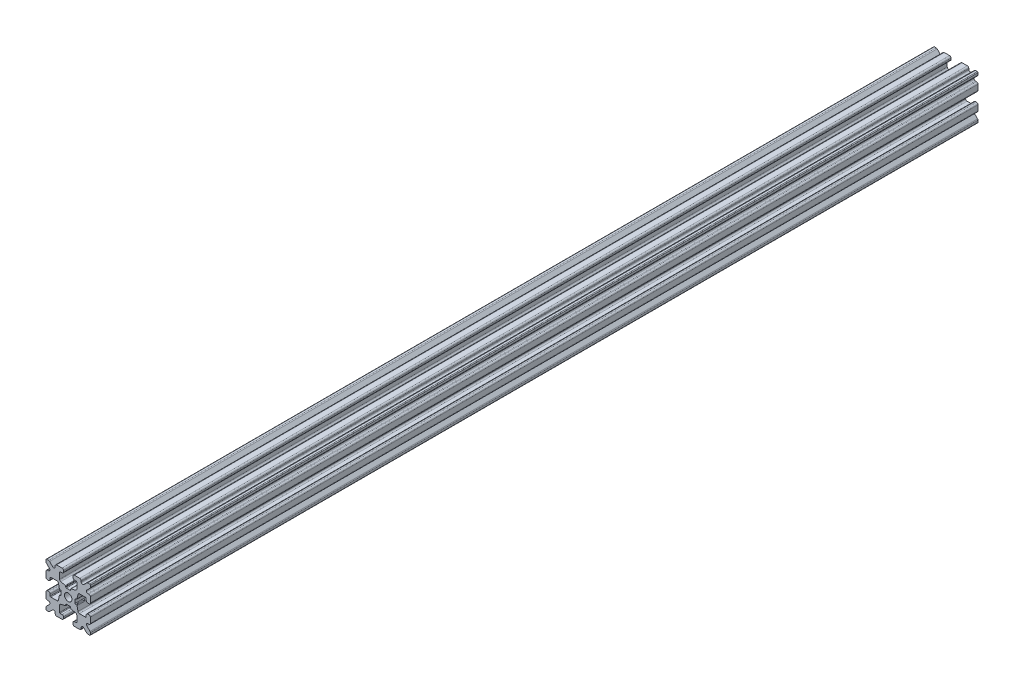
from build123d import *

# Parameters (mm, degrees)
SKETCH1_W           = 15
SKETCH1_H           = 15
SKETCH1_R           = 1.25
CHANGE_LENGTH_DEPTH = 150
FILLET1_R           = 0.25
CUT_EXTRUDE1_DEPTH  = 301.187441443
CUT_EXTRUDE3_DEPTH  = 301.187441443
FILLET3_R           = 0.5
FILLET4_R           = 0.5
FILLET5_R           = 3
FILLET6_R           = 0.2
CUT_EXTRUDE4_DEPTH  = 301.187441443
FILLET8_R           = 0.5
SKETCH6_W           = 5.1529354
SKETCH6_H           = 1.651
SKETCH6_W_2         = 1.651
SKETCH6_H_2         = 5.1529354
CUT_EXTRUDE5_DEPTH  = 301.187441443
FILLET10_R          = 0.2


with BuildPart() as part:
    # Sketch1 → Change length (new, symmetric)
    with BuildSketch(Plane.XY):
        Rectangle(SKETCH1_W, SKETCH1_H)
        Circle(SKETCH1_R, mode=Mode.SUBTRACT)
    extrude(amount=CHANGE_LENGTH_DEPTH, both=True)

    # Fillet1
    fillet1_edges = [part.edges().sort_by_distance(p)[0] for p in [
        (7.5, -7.5, 0),
        (-7.5, -7.5, 0),
        (-7.5, 7.5, 0),
        (7.5, 7.5, 0),
    ]]
    fillet(fillet1_edges, radius=FILLET1_R)

    # Sketch2 → Cut-Extrude1 (cut, through all)
    with BuildSketch(Plane.XY.offset(150)):
        Polygon((-7.5, 1.6), (-6.1, 1.6), (-6.1, 2.9), (-3.4, 2.9), (-3.4, -2.9), (-6.1, -2.9), (-6.1, -1.6), (-7.5, -1.6), align=None)
        Polygon((2.9, 6.1), (1.6, 6.1), (1.6, 7.5), (-1.6, 7.5), (-1.6, 6.1), (-2.9, 6.1), (-2.9, 3.4), (2.9, 3.4), align=None)
        Polygon((-1.6, -7.5), (-1.6, -6.1), (-2.9, -6.1), (-2.9, -3.4), (2.9, -3.4), (2.9, -6.1), (1.6, -6.1), (1.6, -7.5), align=None)
        Polygon((6.1, -2.9), (6.1, -1.6), (7.5, -1.6), (7.5, 1.6), (6.1, 1.6), (6.1, 2.9), (3.4, 2.9), (3.4, -2.9), align=None)
    extrude(amount=-CUT_EXTRUDE1_DEPTH, mode=Mode.SUBTRACT)

    # Sketch4 → Cut-Extrude3 (cut, through all)
    with BuildSketch(Plane.XY.offset(150)):
        Polygon((-3.4, 2.9), (-2.75, 0), (-3.4, -2.9), align=None)
        Polygon((-2.9, 3.4), (0, 2.75), (2.9, 3.4), align=None)
        Polygon((3.4, 2.9), (2.75, 0), (3.4, -2.9), align=None)
        Polygon((-2.9, -3.4), (0, -2.75), (2.9, -3.4), align=None)
    extrude(amount=-CUT_EXTRUDE3_DEPTH, mode=Mode.SUBTRACT)

    # Fillet3
    fillet3_edges = [part.edges().sort_by_distance(p)[0] for p in [
        (1.6, -7.5, 0),
        (-1.6, -7.5, 0),
        (-1.6, -6.1, 0),
        (1.6, -6.1, 0),
        (6.1, 1.6, 0),
        (7.5, 1.6, 0),
        (7.5, -1.6, 0),
        (6.1, -1.6, 0),
        (-7.5, -1.6, 0),
        (-7.5, 1.6, 0),
        (-6.1, 1.6, 0),
        (-6.1, -1.6, 0),
        (-1.6, 6.1, 0),
        (-1.6, 7.5, 0),
        (1.6, 7.5, 0),
        (1.6, 6.1, 0),
    ]]
    fillet(fillet3_edges, radius=FILLET3_R)

    # Fillet4
    fillet4_edges = [part.edges().sort_by_distance(p)[0] for p in [
        (-2.9, -3.4, 0),
        (2.9, -3.4, 0),
        (3.4, -2.9, 0),
        (3.4, 2.9, 0),
        (-3.4, 2.9, 0),
        (-3.4, -2.9, 0),
        (2.9, 3.4, 0),
        (-2.9, 3.4, 0),
    ]]
    fillet(fillet4_edges, radius=FILLET4_R)

    # Fillet5
    fillet5_edges = [part.edges().sort_by_distance(p)[0] for p in [
        (-2.75, 0, 0),
        (0, 2.75, 0),
        (2.75, 0, 0),
        (0, -2.75, 0),
    ]]
    fillet(fillet5_edges, radius=FILLET5_R)

    # Fillet6
    fillet6_edges = [part.edges().sort_by_distance(p)[0] for p in [
        (-2.9, -6.1, 0),
        (2.9, -6.1, 0),
        (6.1, -2.9, 0),
        (6.1, 2.9, 0),
        (-6.1, 2.9, 0),
        (-6.1, -2.9, 0),
        (2.9, 6.1, 0),
        (-2.9, 6.1, 0),
    ]]
    fillet(fillet6_edges, radius=FILLET6_R)

    # Sketch5 → Cut-Extrude4 (cut, through all)
    with BuildSketch(Plane.XY.offset(150)):
        Polygon((-7.5, 6.439339828), (-5.460660172, 4.4), (-7.5, 4.4), align=None)
        Polygon((-6.439339828, 7.5), (-4.4, 5.460660172), (-4.4, 7.5), align=None)
        Polygon((4.4, 7.5), (6.439339828, 7.5), (4.4, 5.460660172), align=None)
        Polygon((7.5, 6.439339828), (7.5, 4.4), (5.460660172, 4.4), align=None)
        Polygon((7.5, -6.439339828), (5.460660172, -4.4), (7.5, -4.4), align=None)
        Polygon((6.439339828, -7.5), (4.4, -5.460660172), (4.4, -7.5), align=None)
        Polygon((-4.4, -7.5), (-6.439339828, -7.5), (-4.4, -5.460660172), align=None)
        Polygon((-7.5, -6.439339828), (-7.5, -4.4), (-5.460660172, -4.4), align=None)
    extrude(amount=-CUT_EXTRUDE4_DEPTH, mode=Mode.SUBTRACT)

    # Fillet8
    fillet8_edges = [part.edges().sort_by_distance(p)[0] for p in [
        (-7.5, 4.4, 0),
        (-7.5, 6.439339828, 0),
        (-5.460660172, 4.4, 0),
        (7.5, -4.4, 0),
        (7.5, -6.439339828, 0),
        (5.460660172, -4.4, 0),
        (5.460660172, 4.4, 0),
        (7.5, 6.439339828, 0),
        (7.5, 4.4, 0),
        (-4.4, 7.5, 0),
        (-4.4, 5.460660172, 0),
        (-6.439339828, 7.5, 0),
        (-5.460660172, -4.4, 0),
        (-7.5, -6.439339828, 0),
        (-7.5, -4.4, 0),
        (4.4, 5.460660172, 0),
        (4.4, 7.5, 0),
        (6.439339828, 7.5, 0),
        (6.439339828, -7.5, 0),
        (4.4, -7.5, 0),
        (4.4, -5.460660172, 0),
        (-6.439339828, -7.5, 0),
        (-4.4, -5.460660172, 0),
        (-4.4, -7.5, 0),
    ]]
    fillet(fillet8_edges, radius=FILLET8_R)

    # Sketch6 → Cut-Extrude5 (cut, through all)
    with BuildSketch(Plane.XY.offset(150)):
        with Locations((4.9235323, 0)):
            Rectangle(SKETCH6_W, SKETCH6_H)
        with Locations((0, -4.9235323)):
            Rectangle(SKETCH6_W_2, SKETCH6_H_2)
        with Locations((-4.9235323, 0)):
            Rectangle(SKETCH6_W, SKETCH6_H)
        with Locations((0, 4.9235323)):
            Rectangle(SKETCH6_W_2, SKETCH6_H_2)
    extrude(amount=-CUT_EXTRUDE5_DEPTH, mode=Mode.SUBTRACT)

    # Fillet10
    fillet10_edges = [part.edges().sort_by_distance(p)[0] for p in [
        (0.8255, -2.935025862, 0),
        (-0.8255, -2.935025862, 0),
        (0.8255, -2.3470646, 0),
        (-0.8255, -2.3470646, 0),
        (2.935025862, 0.8255, 0),
        (2.935025862, -0.8255, 0),
        (2.3470646, 0.8255, 0),
        (2.3470646, -0.8255, 0),
        (-2.935025862, -0.8255, 0),
        (-2.935025862, 0.8255, 0),
        (-2.3470646, -0.8255, 0),
        (-2.3470646, 0.8255, 0),
        (-0.8255, 2.935025862, 0),
        (0.8255, 2.935025862, 0),
        (-0.8255, 2.3470646, 0),
        (0.8255, 2.3470646, 0),
    ]]
    fillet(fillet10_edges, radius=FILLET10_R)


solid = part.part
